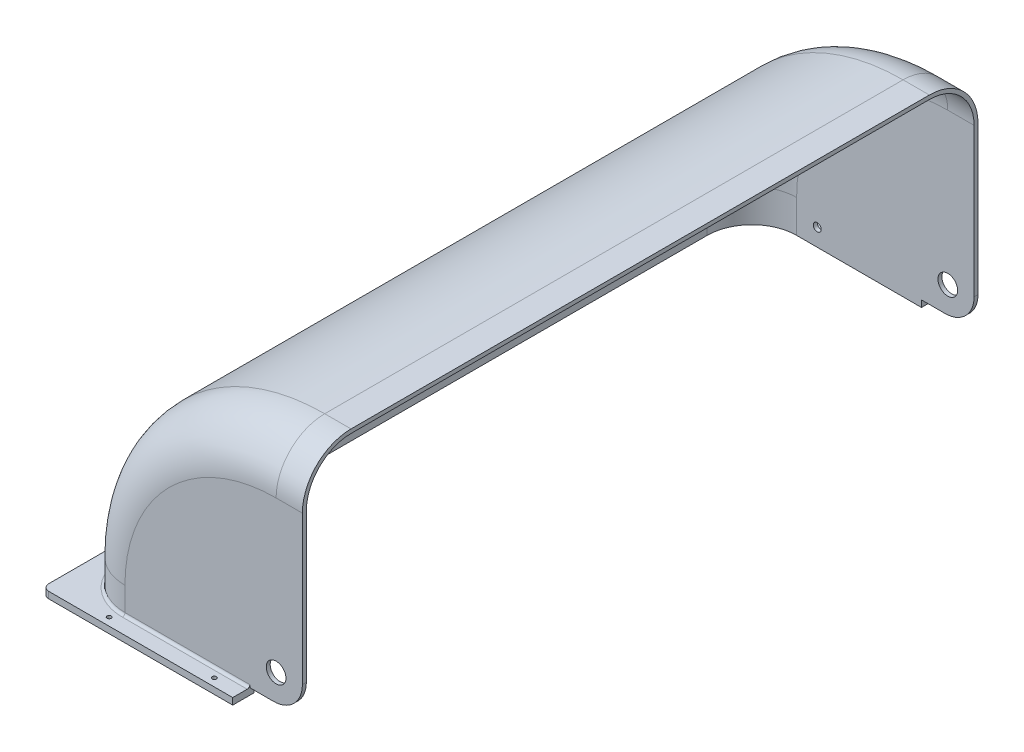
from build123d import *

# Parameters (mm, degrees)
SKETCH1_R           = 1.6
BOSS_EXTRUDE1_DEPTH = 5
BOSS_EXTRUDE5_DEPTH = 20
FILLET8_R           = 34
FILLET9_R           = 37
REVOLVE4_ANGLE      = 90
BOSS_EXTRUDE6_DEPTH = 20
CUT_EXTRUDE3_REACH  = 593.738
SKETCH16_W          = 40
SKETCH16_H          = 5
FILLET10_R          = 22
CUT_EXTRUDE4_REACH  = 581.899
SKETCH17_R          = 7.5
FILLET11_R          = 5
FILLET12_R          = 2
SKETCH18_R          = 3
CUT_EXTRUDE5_DEPTH  = 7


with BuildPart() as part:
    # Sketch1 → Boss-Extrude1 (new body)
    with BuildSketch(Plane(origin=(0, 0, 0), x_dir=(1, 0, 0), z_dir=(0, 1, 0))):
        Polygon((-165, 270), (-165, -270), (0, -270), (0, -254), (-149, -254), (-149, 254), (0, 254), (0, 270), align=None)
        with Locations(Location((-159, 130, 0), (0, 0, 270))):
            Circle(SKETCH1_R, mode=Mode.SUBTRACT)
        with Locations(Location((-159, 50, 0), (0, 0, 270))):
            Circle(SKETCH1_R, mode=Mode.SUBTRACT)
        with Locations(Location((-120, 264, 0), (0, 0, 270))):
            Circle(SKETCH1_R, mode=Mode.SUBTRACT)
        with Locations(Location((-40, 264, 0), (0, 0, 270))):
            Circle(SKETCH1_R, mode=Mode.SUBTRACT)
        with Locations(Location((-159, 210, 0), (0, 0, 270))):
            Circle(SKETCH1_R, mode=Mode.SUBTRACT)
        with Locations(Location((-40, -264, 0), (0, 0, 90))):
            Circle(SKETCH1_R, mode=Mode.SUBTRACT)
        with Locations(Location((-120, -264, 0), (0, 0, 90))):
            Circle(SKETCH1_R, mode=Mode.SUBTRACT)
        with Locations(Location((-159, -210, 0), (0, 0, 90))):
            Circle(SKETCH1_R, mode=Mode.SUBTRACT)
        with Locations(Location((-159, -50, 0), (0, 0, 90))):
            Circle(SKETCH1_R, mode=Mode.SUBTRACT)
        with Locations(Location((-159, -130, 0), (0, 0, 90))):
            Circle(SKETCH1_R, mode=Mode.SUBTRACT)
    extrude(amount=BOSS_EXTRUDE1_DEPTH)

    # Sketch12 → Boss-Extrude5 (add)
    with BuildSketch(Plane(origin=(0, 5, 0), x_dir=(1, 0, 0), z_dir=(0, 1, 0))):
        Polygon((0, 254), (-149, 254), (-149, -254), (0, -254), (0, -257), (-152, -257), (-152, 257), (0, 257), align=None)
    extrude(amount=BOSS_EXTRUDE5_DEPTH)

    # Fillet8
    fillet8_edges = [part.edges().sort_by_distance(p)[0] for p in [
        (-149, 12.5, -254),
        (-149, 12.5, 254),
    ]]
    fillet(fillet8_edges, radius=FILLET8_R)

    # Fillet9
    fillet9_edges = [part.edges().sort_by_distance(p)[0] for p in [
        (-152, 15, -257),
        (-152, 15, 257),
    ]]
    fillet(fillet9_edges, radius=FILLET9_R)

    # Sketch13 → Revolve4 (revolve)
    with BuildSketch(Plane(origin=(0, 25, 0), x_dir=(1, 0, 0), z_dir=(0, 1, 0))):
        with BuildLine():
            Line((0, 254), (-115, 254))
            ThreePointArc((-115, 254), (-139.04163056, 244.04163056), (-149, 220))
            Line((-149, 220), (-149, -220))
            ThreePointArc((-149, -220), (-139.04163056, -244.04163056), (-115, -254))
            Line((-115, -254), (0, -254))
            Line((0, -254), (0, -257))
            Line((0, -257), (-115, -257))
            ThreePointArc((-115, -257), (-141.162950904, -246.162950904), (-152, -220))
            Line((-152, -220), (-152, 220))
            ThreePointArc((-152, 220), (-141.162950904, 246.162950904), (-115, 257))
            Line((-115, 257), (0, 257))
            Line((0, 257), (0, 254))
        make_face()
    revolve(axis=Axis((0, 25, -257), (0, 0, -1)), revolution_arc=REVOLVE4_ANGLE)

    # Sketch15 → Boss-Extrude6 (add)
    with BuildSketch(Plane(origin=(0, 0, 0), x_dir=(0, 0, -1), z_dir=(1, 0, 0))):
        with BuildLine():
            Line((-254, 5), (-254, 140))
            ThreePointArc((-254, 140), (-244.04163056, 164.04163056), (-220, 174))
            Line((-220, 174), (220, 174))
            ThreePointArc((220, 174), (244.04163056, 164.04163056), (254, 140))
            Line((254, 140), (254, 5))
            Line((254, 5), (254, 0))
            Line((254, 0), (270, 0))
            Line((270, 0), (270, 5))
            Line((270, 5), (257, 5))
            Line((257, 5), (257, 140))
            ThreePointArc((257, 140), (246.162950904, 166.162950904), (220, 177))
            Line((220, 177), (-220, 177))
            ThreePointArc((-220, 177), (-246.162950904, 166.162950904), (-257, 140))
            Line((-257, 140), (-257, 5))
            Line((-257, 5), (-270, 5))
            Line((-270, 5), (-270, 0))
            Line((-270, 0), (-254, 0))
            Line((-254, 0), (-254, 5))
        make_face()
    extrude(amount=BOSS_EXTRUDE6_DEPTH)

    # Cut-Extrude3: up to this face of the body (flat: up to its plane)
    cut_extrude3_end = Plane(part.part.faces().sort_by_distance((-72.5, 2.5, -270))[0])
    # Sketch16 → Cut-Extrude3 (cut, up to the picked face)
    with BuildSketch(Plane.XY.offset(270), mode=Mode.PRIVATE) as cut_extrude3_sk1:
        with Locations((0, 2.5)):
            Rectangle(SKETCH16_W, SKETCH16_H)
    cut_extrude3_tool1 = split(extrude(cut_extrude3_sk1.sketch, amount=-CUT_EXTRUDE3_REACH, mode=Mode.PRIVATE), bisect_by=cut_extrude3_end, keep=Keep.BOTH, mode=Mode.PRIVATE)
    add(cut_extrude3_tool1.solids().sort_by(Axis((0, 2.5, 270), (0, 0, -1)))[0], mode=Mode.SUBTRACT)

    # Fillet10
    fillet10_edges = [part.edges().sort_by_distance(p)[0] for p in [
        (20, 5, 255.5),
        (20, 5, -255.5),
    ]]
    fillet(fillet10_edges, radius=FILLET10_R)

    # Cut-Extrude4: up to this face of the body (flat: up to its plane)
    cut_extrude4_end = Plane(part.part.faces().sort_by_distance((-40.16059182, 65.16059182, -257))[0])
    # Sketch17 → Cut-Extrude4 (cut, up to the picked face)
    with BuildSketch(Plane.XY.offset(257), mode=Mode.PRIVATE) as cut_extrude4_sk1:
        with Locations((0, 25)):
            Circle(SKETCH17_R)
    cut_extrude4_tool1 = split(extrude(cut_extrude4_sk1.sketch, amount=-CUT_EXTRUDE4_REACH, mode=Mode.PRIVATE), bisect_by=cut_extrude4_end, keep=Keep.BOTH, mode=Mode.PRIVATE)
    add(cut_extrude4_tool1.solids().sort_by(Axis((0, 25, 257), (0, 0, -1)))[0], mode=Mode.SUBTRACT)

    # Fillet11
    fillet11_edges = [part.edges().sort_by_distance(p)[0] for p in [
        (-165, 2.5, 270),
        (-165, 2.5, -270),
    ]]
    fillet(fillet11_edges, radius=FILLET11_R)

    # Fillet12
    fillet12_edges = [part.edges().sort_by_distance(p)[0] for p in [
        (-152, 5, 0),
        (-67.5, 5, 257),
        (-141.162950904, 5, -246.162950904),
        (-141.162950904, 5, 246.162950904),
        (-67.5, 5, -257),
    ]]
    fillet(fillet12_edges, radius=FILLET12_R)

    # Sketch18 → Cut-Extrude5 (cut)
    with BuildSketch(Plane(origin=(0, 0, -257), x_dir=(-1, 0, 0), z_dir=(0, 0, -1))):
        with Locations((99.306112319, 13.240065646)):
            Circle(SKETCH18_R)
    extrude(amount=-CUT_EXTRUDE5_DEPTH, mode=Mode.SUBTRACT)


solid = part.part
